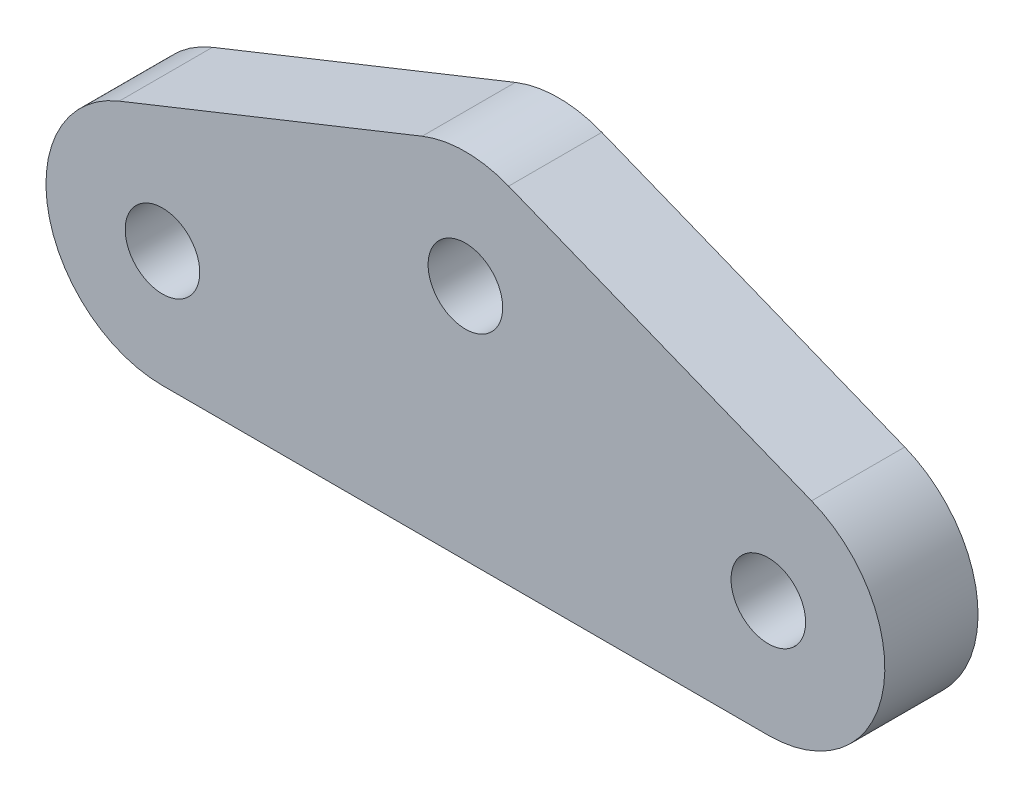
from build123d import *

# Parameters (mm, degrees)
SKETCH_2_R      = 1.6
EXTRUDE_1_DEPTH = 4


with BuildPart() as part:
    # ｽｹｯﾁ2 → ﾎﾞｽ - 押し出し1 (new body)
    with BuildSketch(Plane.XY):
        with BuildLine():
            Line((-14.855768722, 4.642857143), (-1.855768722, 9.839009566))
            ThreePointArc((-1.855768722, 9.839009566), (0, 10.196152423), (1.855768722, 9.839009566))
            Line((1.855768722, 9.839009566), (14.855768722, 4.642857143))
            ThreePointArc((14.855768722, 4.642857143), (17.90990253, -0.944911183), (13, -5))
            Line((13, -5), (-13, -5))
            ThreePointArc((-13, -5), (-17.90990253, -0.944911183), (-14.855768722, 4.642857143))
        make_face()
        with Locations((-13, 0)):
            Circle(SKETCH_2_R, mode=Mode.SUBTRACT)
        with Locations((0, 5.196152423)):
            Circle(SKETCH_2_R, mode=Mode.SUBTRACT)
        with Locations((13, 0)):
            Circle(SKETCH_2_R, mode=Mode.SUBTRACT)
    extrude(amount=EXTRUDE_1_DEPTH)


solid = part.part
